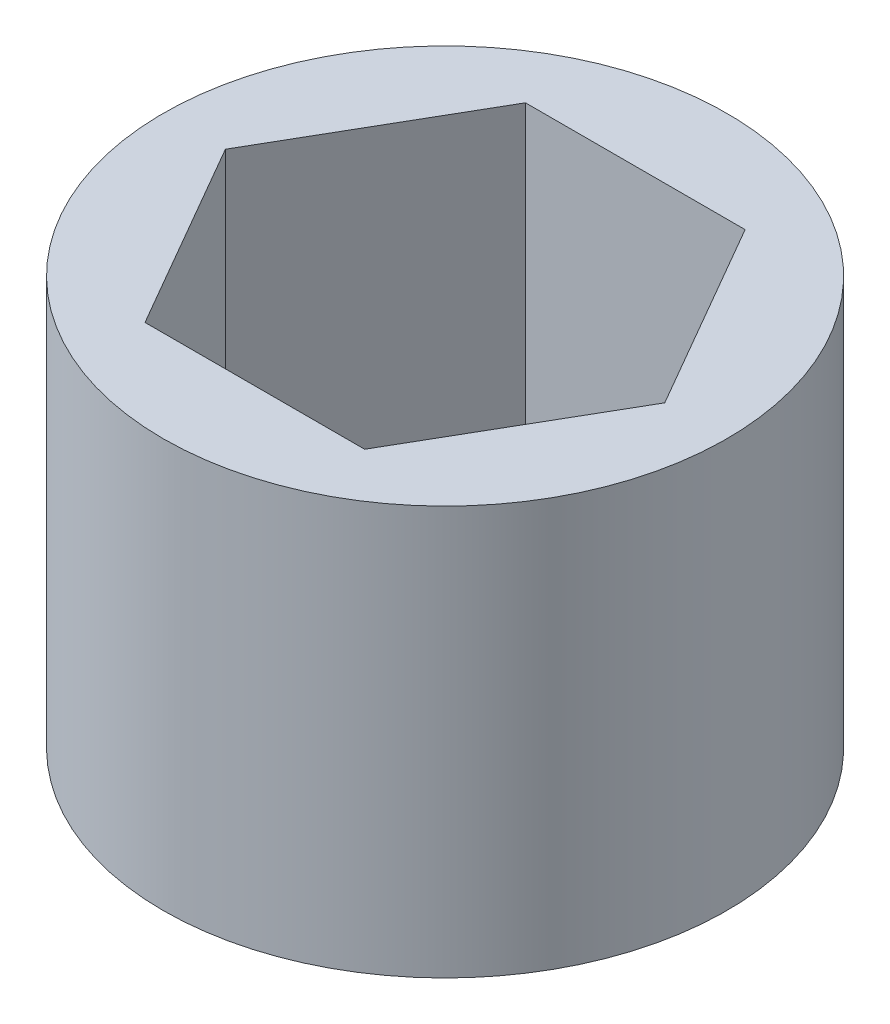
from build123d import *

# Parameters (mm, degrees)
SKETCH1_R           = 10.16
BOSS_EXTRUDE1_DEPTH = 14.732


with BuildPart() as part:
    # Sketch1 → Boss-Extrude1 (new body)
    with BuildSketch(Plane(origin=(0, 0, 0), x_dir=(1, 0, 0), z_dir=(0, 1, 0))):
        with Locations(Location((0, 0, 0), (0, 0, 270))):
            Circle(SKETCH1_R)
        Polygon((7.918936292, 0), (3.959468146, 6.858), (-3.959468146, 6.858), (-7.918936292, 0), (-3.959468146, -6.858), (3.959468146, -6.858), align=None, mode=Mode.SUBTRACT)
    extrude(amount=BOSS_EXTRUDE1_DEPTH)


solid = part.part
